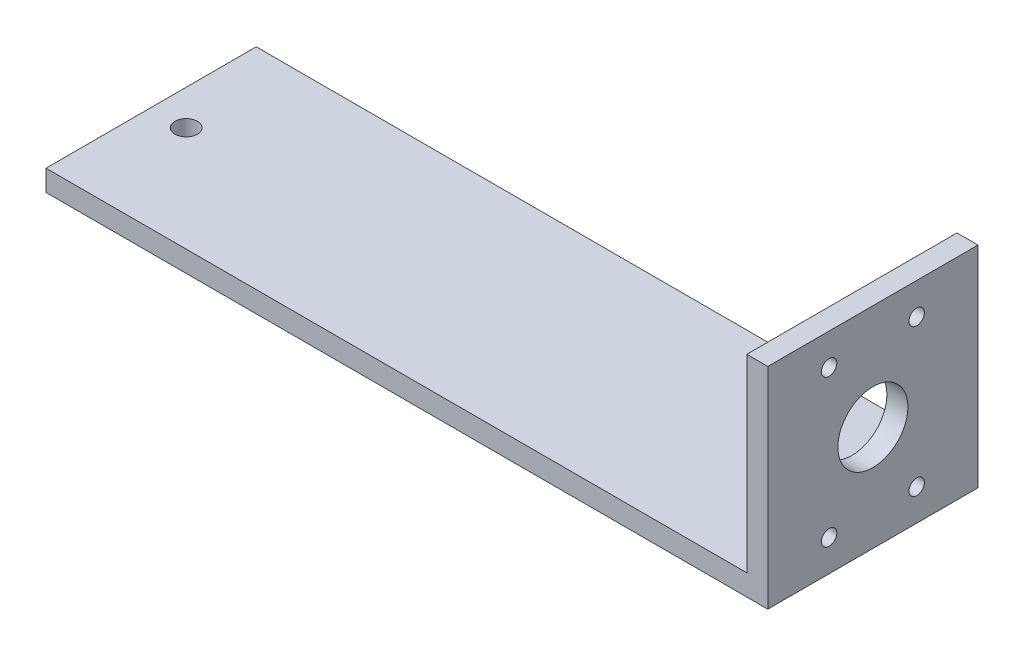
from build123d import *

# Parameters (mm, degrees)
SKETCH1_W           = 100
SKETCH1_H           = 30
BOSS_EXTRUDE1_DEPTH = 3
SKETCH2_R           = 1.6
CUT_EXTRUDE1_DEPTH  = 53.28766585
SKETCH5_W           = 30
SKETCH5_H           = 30
BOSS_EXTRUDE2_DEPTH = 3
SKETCH6_R           = 1.1
CUT_EXTRUDE2_DEPTH  = 109.323589305
SKETCH7_R           = 5
CUT_EXTRUDE3_DEPTH  = 109.323589305


with BuildPart() as part:
    # Sketch1 → Boss-Extrude1 (new body)
    with BuildSketch(Plane(origin=(0, 0, 0), x_dir=(1, 0, 0), z_dir=(0, 1, 0))):
        Rectangle(SKETCH1_W, SKETCH1_H)
    extrude(amount=BOSS_EXTRUDE1_DEPTH)

    # Sketch2 → Cut-Extrude1 (cut, through all)
    with BuildSketch(Plane(origin=(0, 3, 0), x_dir=(1, 0, 0), z_dir=(0, 1, 0))):
        with Locations(Location((45, 0, 0), (0, 0, 270))):
            Circle(SKETCH2_R)
        with Locations(Location((-45, 0, 0), (0, 0, 90))):
            Circle(SKETCH2_R)
    extrude(amount=-CUT_EXTRUDE1_DEPTH, mode=Mode.SUBTRACT)

    # Sketch5 → Boss-Extrude2 (add)
    with BuildSketch(Plane(origin=(50, 0, 0), x_dir=(0, 0, -1), z_dir=(1, 0, 0))):
        with Locations((0, 15)):
            Rectangle(SKETCH5_W, SKETCH5_H)
    extrude(amount=BOSS_EXTRUDE2_DEPTH)

    # Sketch6 → Cut-Extrude2 (cut, through all)
    with BuildSketch(Plane(origin=(53, 0, 0), x_dir=(0, 0, -1), z_dir=(1, 0, 0))):
        with Locations((-6.25, 25.5)):
            Circle(SKETCH6_R)
        with Locations(Location((6.25, 25.5, 0), (0, 0, 180))):
            Circle(SKETCH6_R)
        with Locations((6.25, 4.5)):
            Circle(SKETCH6_R)
        with Locations(Location((-6.25, 4.5, 0), (0, 0, 180))):
            Circle(SKETCH6_R)
    extrude(amount=-CUT_EXTRUDE2_DEPTH, mode=Mode.SUBTRACT)

    # Sketch7 → Cut-Extrude3 (cut, through all)
    with BuildSketch(Plane(origin=(53, 0, 0), x_dir=(0, 0, -1), z_dir=(1, 0, 0))):
        with Locations((0, 15)):
            Circle(SKETCH7_R)
    extrude(amount=-CUT_EXTRUDE3_DEPTH, mode=Mode.SUBTRACT)


solid = part.part
